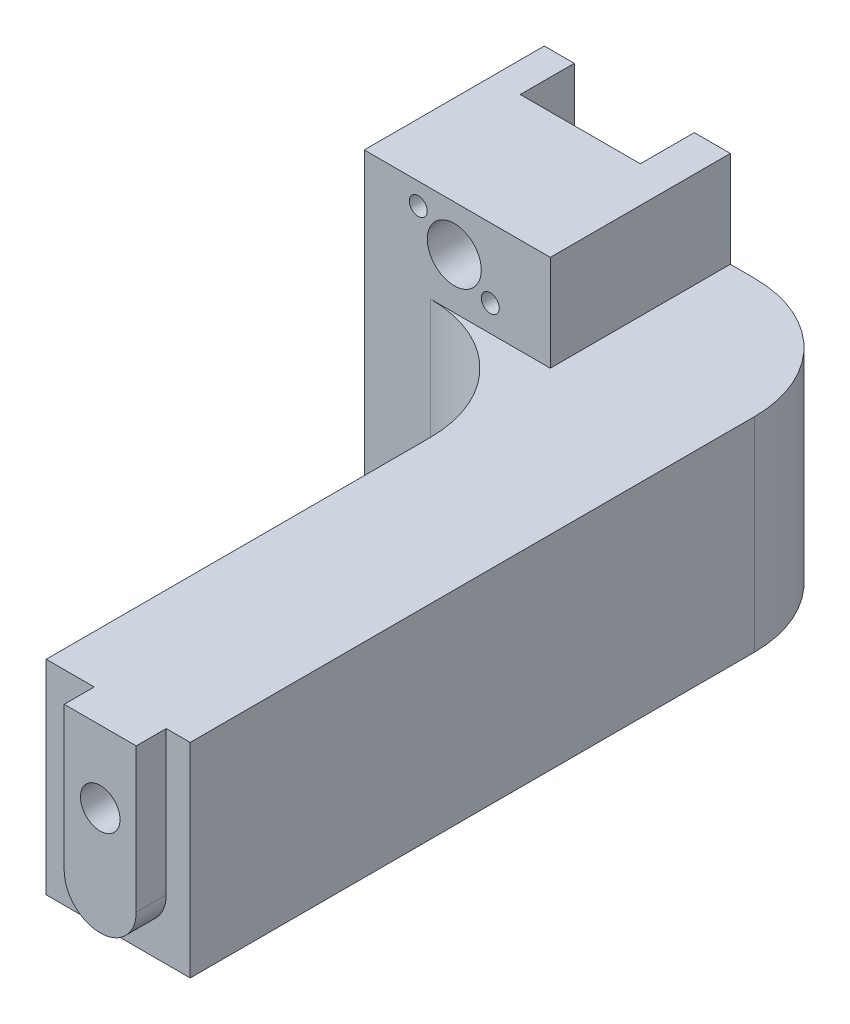
from build123d import *

# Parameters (mm, degrees)
SKETCH1_W                 = 27.5
SKETCH1_H                 = 57
BOSS_EXTRUDE1_DEPTH       = 25
BOSS_EXTRUDE2_DEPTH       = 2.5
CUT_EXTRUDE1_DEPTH        = 4.5
M4X0_7_TAPPED_HOLE1_D     = 3.3
M4X0_7_TAPPED_HOLE1_DEPTH = 10.1
M4X0_7_TAPPED_HOLE1_TIP   = 0.991420021
CUT_EXTRUDE2_DEPTH        = 8
M4_CLEARANCE_HOLE1_D      = 4.5
F_1_5MM_DOWEL_HOLE1_D     = 1.5
SKETCH11_W                = 15.5
SKETCH11_H                = 42
CUT_EXTRUDE3_DEPTH        = 38.934977264
FILLET1_R                 = 10


with BuildPart() as part:
    # Sketch1 → Boss-Extrude1 (new body)
    with BuildSketch(Plane(origin=(0, 0, 0), x_dir=(1, 0, 0), z_dir=(0, 1, 0))):
        Rectangle(SKETCH1_W, SKETCH1_H)
    extrude(amount=BOSS_EXTRUDE1_DEPTH)

    # Sketch2 → Boss-Extrude2 (add)
    with BuildSketch(Plane.XY.offset(28.5)):
        with BuildLine():
            Line((5.75, 5), (5.75, 25))
            Line((5.75, 25), (11.75, 25))
            Line((11.75, 25), (11.75, 5))
            ThreePointArc((11.75, 5), (8.75, 2), (5.75, 5))
        make_face()
    extrude(amount=BOSS_EXTRUDE2_DEPTH)

    # Sketch3 → Cut-Extrude1 (cut)
    with BuildSketch(Plane(origin=(0, 0, -28.5), x_dir=(-1, 0, 0), z_dir=(0, 0, -1))):
        with BuildLine():
            Line((1.25, 25), (11.25, 25))
            Line((11.25, 25), (11.25, 17.2))
            ThreePointArc((11.25, 17.2), (10.517766953, 15.432233047), (8.75, 14.7))
            Line((8.75, 14.7), (3.75, 14.7))
            ThreePointArc((3.75, 14.7), (1.982233047, 15.432233047), (1.25, 17.2))
            Line((1.25, 17.2), (1.25, 25))
        make_face()
    extrude(amount=-CUT_EXTRUDE1_DEPTH, mode=Mode.SUBTRACT)

    # M4x0.7 Tapped Hole1
    with Locations(Plane.XY.offset(31)):
        with Locations((8.75, 11)):
            Hole(M4X0_7_TAPPED_HOLE1_D / 2, depth=M4X0_7_TAPPED_HOLE1_DEPTH)
            with Locations((0, 0, -(M4X0_7_TAPPED_HOLE1_DEPTH + M4X0_7_TAPPED_HOLE1_TIP / 2))):  # 118° drill point
                Cone(0, M4X0_7_TAPPED_HOLE1_D / 2, M4X0_7_TAPPED_HOLE1_TIP, mode=Mode.SUBTRACT)

    # Sketch6 → Cut-Extrude2 (cut)
    with BuildSketch(Plane(origin=(0, 25, 0), x_dir=(1, 0, 0), z_dir=(0, 1, 0))):
        Polygon((-13.75, 13.5), (1.75, 13.5), (1.75, 28.5), (13.75, 28.5), (13.75, 0), (13.75, -28.5), (11.75, -28.5), (11.75, -31), (5.75, -31), (5.75, -28.5), (-13.75, -28.5), align=None)
    extrude(amount=-CUT_EXTRUDE2_DEPTH, mode=Mode.SUBTRACT)

    # M4 Clearance Hole1 (through all)
    with Locations(Plane.XY.offset(-13.5)):
        with Locations((-6.25, 21.2)):
            Hole(M4_CLEARANCE_HOLE1_D / 2)

    # Ø1.5mm Dowel Hole1 (through all)
    with Locations(Plane(origin=(0, 0, -24), x_dir=(-1, 0, 0), z_dir=(0, 0, -1))):
        with Locations((9.25, 23.2), (3.25, 19.2)):
            Hole(F_1_5MM_DOWEL_HOLE1_D / 2)

    # Sketch11 → Cut-Extrude3 (cut, through all)
    with BuildSketch(Plane(origin=(0, 17, 0), x_dir=(1, 0, 0), z_dir=(0, 1, 0))):
        with Locations((-6, -7.5)):
            Rectangle(SKETCH11_W, SKETCH11_H)
    extrude(amount=-CUT_EXTRUDE3_DEPTH, mode=Mode.SUBTRACT)

    # Fillet1
    fillet1_edges = [part.edges().sort_by_distance(p)[0] for p in [
        (1.75, 8.5, -13.5),
        (13.75, 8.5, -28.5),
    ]]
    fillet(fillet1_edges, radius=FILLET1_R)


solid = part.part
